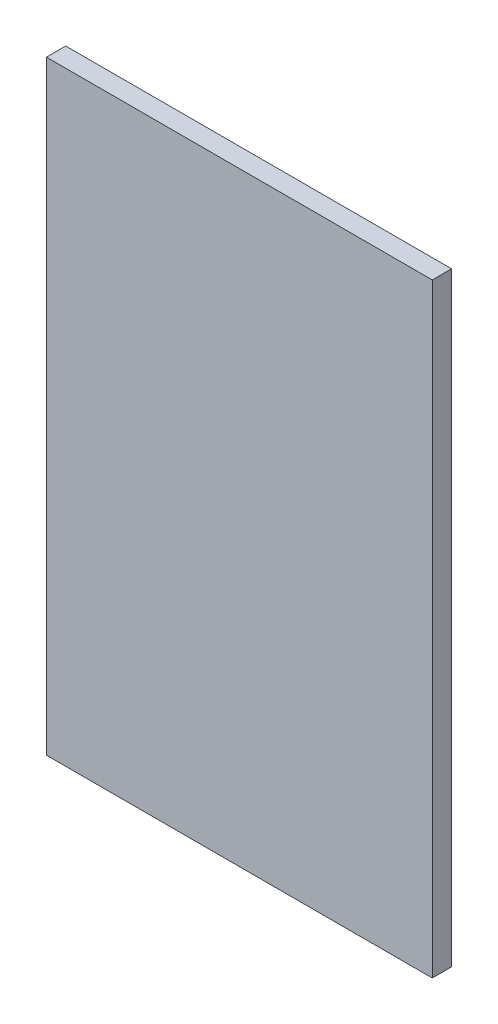
from build123d import *

# Parameters (mm, degrees)
CROQUIS1_W              = 30
CROQUIS1_H              = 47
SALIENTE_EXTRUIR1_DEPTH = 1.5


with BuildPart() as part:
    # Croquis1 → Saliente-Extruir1 (new body)
    with BuildSketch(Plane.XY):
        with Locations((15, 23.5)):
            Rectangle(CROQUIS1_W, CROQUIS1_H)
    extrude(amount=SALIENTE_EXTRUIR1_DEPTH)


solid = part.part
